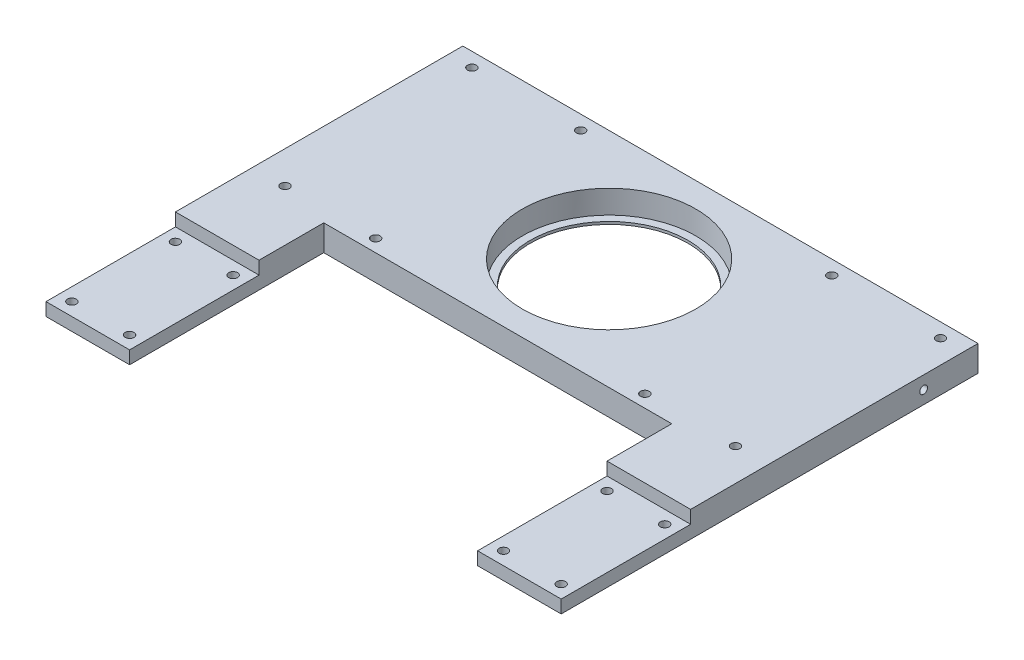
from build123d import *

# Parameters (mm, degrees)
SKIZZE1_W                        = 199
SKIZZE1_H                        = 400
AUFSATZ_LINEAR_AUSTRAGEN1_DEPTH  = 10
SKIZZE5_W                        = 199
SKIZZE5_H                        = 85
SCHNITT_LINEAR_AUSTRAGEN2_DEPTH  = 10
SKIZZE6_R                        = 1.7
SCHNITT_LINEAR_AUSTRAGEN3_DEPTH  = 224.607356766
SCHNITT_LINEAR_AUSTRAGEN4_DEPTH  = 4
SKIZZE16_W                       = 35
SKIZZE16_H                       = 7
SCHNITT_LINEAR_AUSTRAGEN10_DEPTH = 5
SCHNITT_LINEAR_AUSTRAGEN11_DEPTH = 35
SKIZZE20_R                       = 1.7
SCHNITT_LINEAR_AUSTRAGEN12_DEPTH = 224.607356766
SKIZZE21_W                       = 134.422077922
SKIZZE21_H                       = 75
SCHNITT_LINEAR_AUSTRAGEN13_DEPTH = 224.607356766
SCHNITT_LINEAR_AUSTRAGEN14_DEPTH = 224.607356766
AUFSATZ_LINEAR_AUSTRAGEN6_DEPTH  = 10
SKIZZE25_R                       = 1.7
SCHNITT_LINEAR_AUSTRAGEN15_DEPTH = 224.607356766
SCHNITT_LINEAR_AUSTRAGEN16_DEPTH = 283.313655355
SKIZZE27_R                       = 33.5
SCHNITT_LINEAR_AUSTRAGEN17_DEPTH = 153.398326762
SKIZZE28_R                       = 36.006256149
SKIZZE28_R_2                     = 30.5
AUFSATZ_LINEAR_AUSTRAGEN7_DEPTH  = 1
SKIZZE29_R                       = 1.5
SCHNITT_LINEAR_AUSTRAGEN18_DEPTH = 10
SKIZZE30_R                       = 1.5
SCHNITT_LINEAR_AUSTRAGEN19_DEPTH = 10
SKIZZE31_R                       = 2.95
SCHNITT_LINEAR_AUSTRAGEN20_DEPTH = 3.5


with BuildPart() as part:
    # Skizze1 → Aufsatz-Linear austragen1 (new body)
    with BuildSketch(Plane(origin=(0, 0, 0), x_dir=(1, 0, 0), z_dir=(0, 1, 0))):
        Rectangle(SKIZZE1_W, SKIZZE1_H)
    extrude(amount=AUFSATZ_LINEAR_AUSTRAGEN1_DEPTH)

    # Skizze5 → Schnitt-Linear austragen2 (cut)
    with BuildSketch(Plane(origin=(0, 10, 0), x_dir=(1, 0, 0), z_dir=(0, 1, 0))):
        Polygon((99.5, -200), (18, -200), (99.5, -46), align=None)
        Polygon((-18, -200), (-99.5, -46), (-99.5, -200), align=None)
        with Locations((0, 157.5)):
            Rectangle(SKIZZE5_W, SKIZZE5_H)
        Polygon((67.211038961, -46), (-67.211038961, -46), (-2.646103896, -168), (2.646103896, -168), align=None)
    extrude(amount=-SCHNITT_LINEAR_AUSTRAGEN2_DEPTH, mode=Mode.SUBTRACT)

    # Skizze6 → Schnitt-Linear austragen3 (cut, through all)
    with BuildSketch(Plane(origin=(0, 10, 0), x_dir=(1, 0, 0), z_dir=(0, 1, 0))):
        with Locations(Location((-11, -195, 0), (0, 0, 270))):
            Circle(SKIZZE6_R)
        with Locations(Location((-11, -178.18, 0), (0, 0, 90))):
            Circle(SKIZZE6_R)
        with Locations(Location((11, -195, 0), (0, 0, 90))):
            Circle(SKIZZE6_R)
        with Locations(Location((11, -178.18, 0), (0, 0, 270))):
            Circle(SKIZZE6_R)
    extrude(amount=-SCHNITT_LINEAR_AUSTRAGEN3_DEPTH, mode=Mode.SUBTRACT)

    # Skizze7 → Schnitt-Linear austragen4 (cut)
    with BuildSketch(Plane.XZ):
        Polygon((-11, 198.406366588), (-8.05, 196.703183294), (-8.05, 193.296816706), (-11, 191.593633412), (-13.95, 193.296816706), (-13.95, 196.703183294), align=None)
        Polygon((11, 198.406366588), (8.05, 196.703183294), (8.05, 193.296816706), (11, 191.593633412), (13.95, 193.296816706), (13.95, 196.703183294), align=None)
        Polygon((-8.05, 176.476816706), (-8.05, 179.883183294), (-11, 181.586366588), (-13.95, 179.883183294), (-13.95, 176.476816706), (-11, 174.773633412), align=None)
        Polygon((8.05, 176.476816706), (8.05, 179.883183294), (11, 181.586366588), (13.95, 179.883183294), (13.95, 176.476816706), (11, 174.773633412), align=None)
    extrude(amount=-SCHNITT_LINEAR_AUSTRAGEN4_DEPTH, mode=Mode.SUBTRACT)

    # Skizze16 → Schnitt-Linear austragen10 (cut)
    with BuildSketch(Plane.XZ):
        with Locations((0, 186.59)):
            Rectangle(SKIZZE16_W, SKIZZE16_H)
    extrude(amount=-SCHNITT_LINEAR_AUSTRAGEN10_DEPTH, mode=Mode.SUBTRACT)

    # Skizze17 → Schnitt-Linear austragen11 (cut)
    with BuildSketch(Plane.ZY.offset(-17.5)):
        Polygon((183.09, 5), (186.59, 8.5), (190.09, 5), align=None)
    extrude(amount=SCHNITT_LINEAR_AUSTRAGEN11_DEPTH, mode=Mode.SUBTRACT)

    # Skizze20 → Schnitt-Linear austragen12 (cut, through all)
    with BuildSketch(Plane(origin=(0, 10, 0), x_dir=(1, 0, 0), z_dir=(0, 1, 0))):
        with Locations(Location((90.5, 109.52, 0), (0, 0, 270))):
            Circle(SKIZZE20_R)
        with Locations(Location((48.5, 109.52, 0), (0, 0, 270))):
            Circle(SKIZZE20_R)
        with Locations(Location((-48.5, 109.52, 0), (0, 0, 90))):
            Circle(SKIZZE20_R)
        with Locations(Location((-90.5, 109.52, 0), (0, 0, 90))):
            Circle(SKIZZE20_R)
        with Locations(Location((87, 33.82, 0), (0, 0, 270))):
            Circle(SKIZZE20_R)
        with Locations(Location((52, 33.82, 0), (0, 0, 270))):
            Circle(SKIZZE20_R)
        with Locations(Location((-87, 33.82, 0), (0, 0, 90))):
            Circle(SKIZZE20_R)
        with Locations(Location((-52, 33.82, 0), (0, 0, 90))):
            Circle(SKIZZE20_R)
    extrude(amount=-SCHNITT_LINEAR_AUSTRAGEN12_DEPTH, mode=Mode.SUBTRACT)

    # Skizze21 → Schnitt-Linear austragen13 (cut, through all)
    with BuildSketch(Plane(origin=(0, 10, 0), x_dir=(1, 0, 0), z_dir=(0, 1, 0))):
        with Locations((0, -8.5)):
            Rectangle(SKIZZE21_W, SKIZZE21_H)
    extrude(amount=-SCHNITT_LINEAR_AUSTRAGEN13_DEPTH, mode=Mode.SUBTRACT)

    # Skizze22 → Schnitt-Linear austragen14 (cut, through all)
    with BuildSketch(Plane(origin=(0, 10, 0), x_dir=(1, 0, 0), z_dir=(0, 1, 0))):
        with BuildLine():
            Line((-67.211038961, -46), (-2.646103896, -168))
            ThreePointArc((-2.646103896, -168), (-52.825886854, -116.471631215), (-67.211038961, -46))
        make_face()
    schnitt_linear_austragen14 = extrude(amount=-SCHNITT_LINEAR_AUSTRAGEN14_DEPTH, mode=Mode.SUBTRACT)

    # Skizze23 → Aufsatz-Linear austragen6 (add)
    with BuildSketch(Plane(origin=(0, 10, 0), x_dir=(1, 0, 0), z_dir=(0, 1, 0))):
        with BuildLine():
            Line((-99.5, -46), (-18, -200))
            ThreePointArc((-18, -200), (-75.095260266, -131.650251374), (-99.5, -46))
        make_face()
    aufsatz_linear_austragen6 = extrude(amount=-AUFSATZ_LINEAR_AUSTRAGEN6_DEPTH)

    # Spiegeln2: Schnitt-Linear austragen14, Aufsatz-Linear austragen6 across plane
    add(schnitt_linear_austragen14.mirror(Plane(origin=(0, 0, 0), x_dir=(0, 0, 1), z_dir=(1, 0, 0))), mode=Mode.SUBTRACT)
    add(aufsatz_linear_austragen6.mirror(Plane(origin=(0, 0, 0), x_dir=(0, 0, 1), z_dir=(1, 0, 0))))

    # Skizze25 → Schnitt-Linear austragen15 (cut, through all)
    with BuildSketch(Plane(origin=(0, 10, 0), x_dir=(1, 0, 0), z_dir=(0, 1, 0))):
        with Locations(Location((-94.5, -1, 0), (0, 0, 270))):
            Circle(SKIZZE25_R)
        with Locations(Location((-72.211038961, -1, 0), (0, 0, 90))):
            Circle(SKIZZE25_R)
        with Locations(Location((-72.211038961, -41, 0), (0, 0, 270))):
            Circle(SKIZZE25_R)
        with Locations(Location((-94.5, -41, 0), (0, 0, 90))):
            Circle(SKIZZE25_R)
    schnitt_linear_austragen15 = extrude(amount=-SCHNITT_LINEAR_AUSTRAGEN15_DEPTH, mode=Mode.SUBTRACT)

    # Spiegeln3: Schnitt-Linear austragen15 across plane
    add(schnitt_linear_austragen15.mirror(Plane(origin=(0, 0, 0), x_dir=(0, 0, 1), z_dir=(1, 0, 0))), mode=Mode.SUBTRACT)

    # Skizze26 → Schnitt-Linear austragen16 (cut, through all)
    with BuildSketch(Plane.ZY.offset(99.5)):
        Polygon((-4, 5), (-4, 13.101486595), (200.684563047, 82.546277137), (242.997216492, -41.037631402), (91.241487897, -60.284782055), (46, 0), (46, 5), align=None)
    extrude(amount=-SCHNITT_LINEAR_AUSTRAGEN16_DEPTH, mode=Mode.SUBTRACT)

    # Skizze27 → Schnitt-Linear austragen17 (cut, through all)
    with BuildSketch(Plane(origin=(0, 10, 0), x_dir=(1, 0, 0), z_dir=(0, 1, 0))):
        with Locations(Location((0, 72, 0), (0, 0, 270))):
            Circle(SKIZZE27_R)
    extrude(amount=-SCHNITT_LINEAR_AUSTRAGEN17_DEPTH, mode=Mode.SUBTRACT)

    # Skizze28 → Aufsatz-Linear austragen7 (add)
    with BuildSketch(Plane.XZ):
        with Locations((0, -72)):
            Circle(SKIZZE28_R)
        with Locations(Location((0, -72, 0), (0, 0, 270))):
            Circle(SKIZZE28_R_2, mode=Mode.SUBTRACT)
    extrude(amount=-AUFSATZ_LINEAR_AUSTRAGEN7_DEPTH)

    # Skizze29 → Schnitt-Linear austragen18 (cut)
    with BuildSketch(Plane.ZY.offset(99.5)):
        with Locations((-94, 5)):
            Circle(SKIZZE29_R)
    schnitt_linear_austragen18 = extrude(amount=-SCHNITT_LINEAR_AUSTRAGEN18_DEPTH, mode=Mode.SUBTRACT)

    # Skizze30 → Schnitt-Linear austragen19 (cut)
    with BuildSketch(Plane(origin=(0, 0, -115), x_dir=(-1, 0, 0), z_dir=(0, 0, -1))):
        with Locations((94.5, 5)):
            Circle(SKIZZE30_R)
        with Locations((78.5, 5)):
            Circle(SKIZZE30_R)
    schnitt_linear_austragen19 = extrude(amount=-SCHNITT_LINEAR_AUSTRAGEN19_DEPTH, mode=Mode.SUBTRACT)

    # Spiegeln4: Schnitt-Linear austragen18, Schnitt-Linear austragen19 across plane
    add(schnitt_linear_austragen18.mirror(Plane(origin=(0, 0, 0), x_dir=(0, 0, 1), z_dir=(1, 0, 0))), mode=Mode.SUBTRACT)
    add(schnitt_linear_austragen19.mirror(Plane(origin=(0, 0, 0), x_dir=(0, 0, 1), z_dir=(1, 0, 0))), mode=Mode.SUBTRACT)

    # Skizze31 → Schnitt-Linear austragen20 (cut)
    with BuildSketch(Plane.XZ):
        with Locations(Location((-90.5, -109.52, 0), (0, 0, 270))):
            Circle(SKIZZE31_R)
        with Locations(Location((-48.5, -109.52, 0), (0, 0, 270))):
            Circle(SKIZZE31_R)
        with Locations(Location((-87, -33.82, 0), (0, 0, 270))):
            Circle(SKIZZE31_R)
        with Locations(Location((-52, -33.82, 0), (0, 0, 270))):
            Circle(SKIZZE31_R)
        with Locations(Location((52, -33.82, 0), (0, 0, 90))):
            Circle(SKIZZE31_R)
        with Locations(Location((87, -33.82, 0), (0, 0, 90))):
            Circle(SKIZZE31_R)
        with Locations(Location((48.5, -109.52, 0), (0, 0, 90))):
            Circle(SKIZZE31_R)
        with Locations(Location((90.5, -109.52, 0), (0, 0, 90))):
            Circle(SKIZZE31_R)
    extrude(amount=-SCHNITT_LINEAR_AUSTRAGEN20_DEPTH, mode=Mode.SUBTRACT)


solid = part.part
